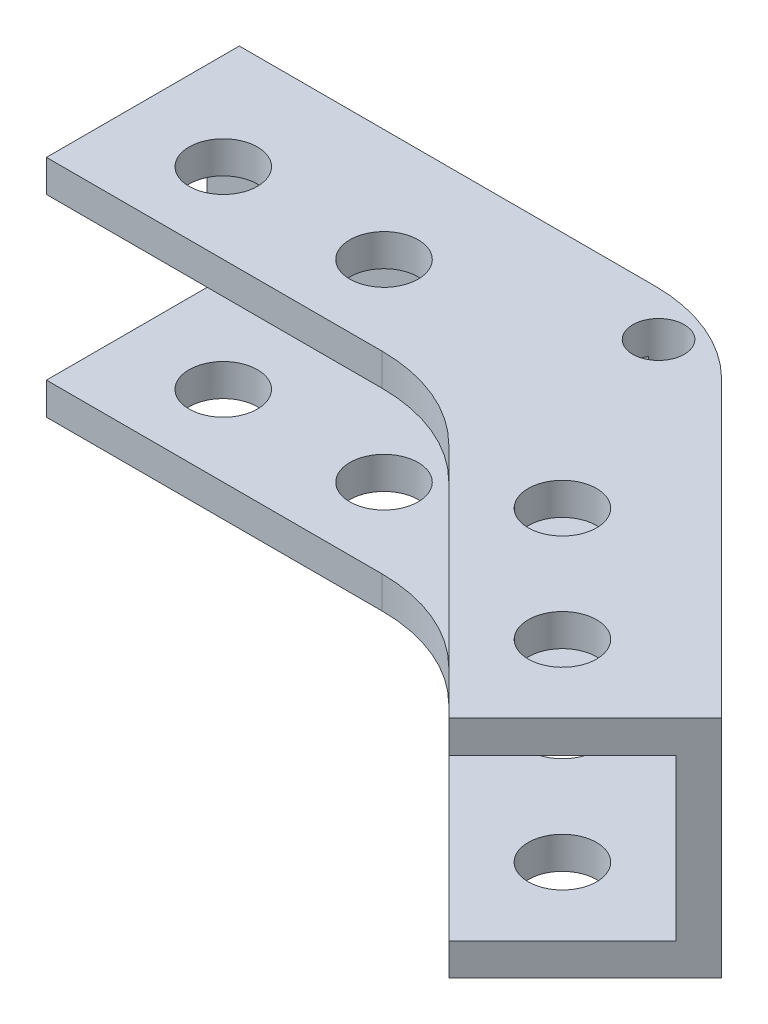
from build123d import *

# Parameters (mm, degrees)
BOSS_EXTRUDE1_DEPTH = 14
BOSS_EXTRUDE2_DEPTH = 2
BOSS_EXTRUDE3_DEPTH = 2
SKETCH4_R           = 2.125
CUT_EXTRUDE1_DEPTH  = 15
SKETCH5_R           = 1.6
CUT_EXTRUDE2_DEPTH  = 15
SKETCH6_W           = 7
SKETCH6_H           = 6
CUT_EXTRUDE3_DEPTH  = 15
SKETCH7_W           = 7
SKETCH7_H           = 6
CUT_EXTRUDE4_DEPTH  = 15
FILLET2_R           = 10
FILLET3_R           = 10


with BuildPart() as part:
    # Sketch1 → Boss-Extrude1 (new body)
    with BuildSketch(Plane(origin=(0, 0, 0), x_dir=(1, 0, 0), z_dir=(0, 1, 0))):
        Polygon((-27.184182145, 10), (2.815817855, 10), (24.029021291, -11.213203436), (22.614807728, -12.627416998), (1.98739073, 8), (-27.184182145, 8), align=None)
    extrude(amount=BOSS_EXTRUDE1_DEPTH)

    # Sketch2 → Boss-Extrude2 (add)
    with BuildSketch(Plane(origin=(0, 14, 0), x_dir=(1, 0, 0), z_dir=(0, 1, 0))):
        Polygon((-27.184182145, 8), (-27.184182145, -2), (-2.154744893, -2), (15.543739917, -19.69848481), (22.614807728, -12.627416998), (1.98739073, 8), align=None)
    extrude(amount=-BOSS_EXTRUDE2_DEPTH)

    # Sketch3 → Boss-Extrude3 (add)
    with BuildSketch(Plane.XZ):
        Polygon((-27.184182145, -8), (-27.184182145, 2), (-2.154744893, 2), (15.543739917, 19.69848481), (22.614807728, 12.627416998), (1.98739073, -8), align=None)
    extrude(amount=-BOSS_EXTRUDE3_DEPTH)

    # Sketch4 → Cut-Extrude1 (cut)
    with BuildSketch(Plane(origin=(0, 14, 0), x_dir=(1, 0, 0), z_dir=(0, 1, 0))):
        with Locations(Location((-21.184182145, 3, 0), (0, 0, 270))):
            Circle(SKETCH4_R)
        with Locations(Location((-11.184182145, 3, 0), (0, 0, 270))):
            Circle(SKETCH4_R)
        with Locations(Location((7.765565323, -4.849242405, 0), (0, 0, 270))):
            Circle(SKETCH4_R)
        with Locations(Location((14.836633135, -11.920310217, 0), (0, 0, 270))):
            Circle(SKETCH4_R)
    extrude(amount=-CUT_EXTRUDE1_DEPTH, mode=Mode.SUBTRACT)

    # Sketch5 → Cut-Extrude2 (cut)
    with BuildSketch(Plane(origin=(0, 14, 0), x_dir=(1, 0, 0), z_dir=(0, 1, 0))):
        with Locations(Location((1.667767558, 7.228361402, 0), (0, 0, 270))):
            Circle(SKETCH5_R)
    extrude(amount=-CUT_EXTRUDE2_DEPTH, mode=Mode.SUBTRACT)

    # Sketch6 → Cut-Extrude3 (cut)
    with BuildSketch(Plane(origin=(0, 0, -10), x_dir=(-1, 0, 0), z_dir=(0, 0, -1))):
        with Locations((0.684182145, 7)):
            Rectangle(SKETCH6_W, SKETCH6_H)
    extrude(amount=-CUT_EXTRUDE3_DEPTH, mode=Mode.SUBTRACT)

    # Sketch7 → Cut-Extrude4 (cut)
    with BuildSketch(Plane(origin=(6.407908928, 0, -6.407908928), x_dir=(-0.7071067811865465, 0, -0.7071067811865487), z_dir=(0.7071067811865487, 0, -0.7071067811865465))):
        with Locations((1.579983912, 7)):
            Rectangle(SKETCH7_W, SKETCH7_H)
    extrude(amount=-CUT_EXTRUDE4_DEPTH, mode=Mode.SUBTRACT)

    # Fillet2
    fillet2_edges = [part.edges().sort_by_distance(p)[0] for p in [
        (2.815817855, 2, -10),
        (2.815817855, 12, -10),
    ]]
    fillet(fillet2_edges, radius=FILLET2_R)

    # Fillet3
    fillet3_edges = [part.edges().sort_by_distance(p)[0] for p in [
        (-2.154744893, 13, 2),
        (-2.154744893, 1, 2),
    ]]
    fillet(fillet3_edges, radius=FILLET3_R)


solid = part.part
